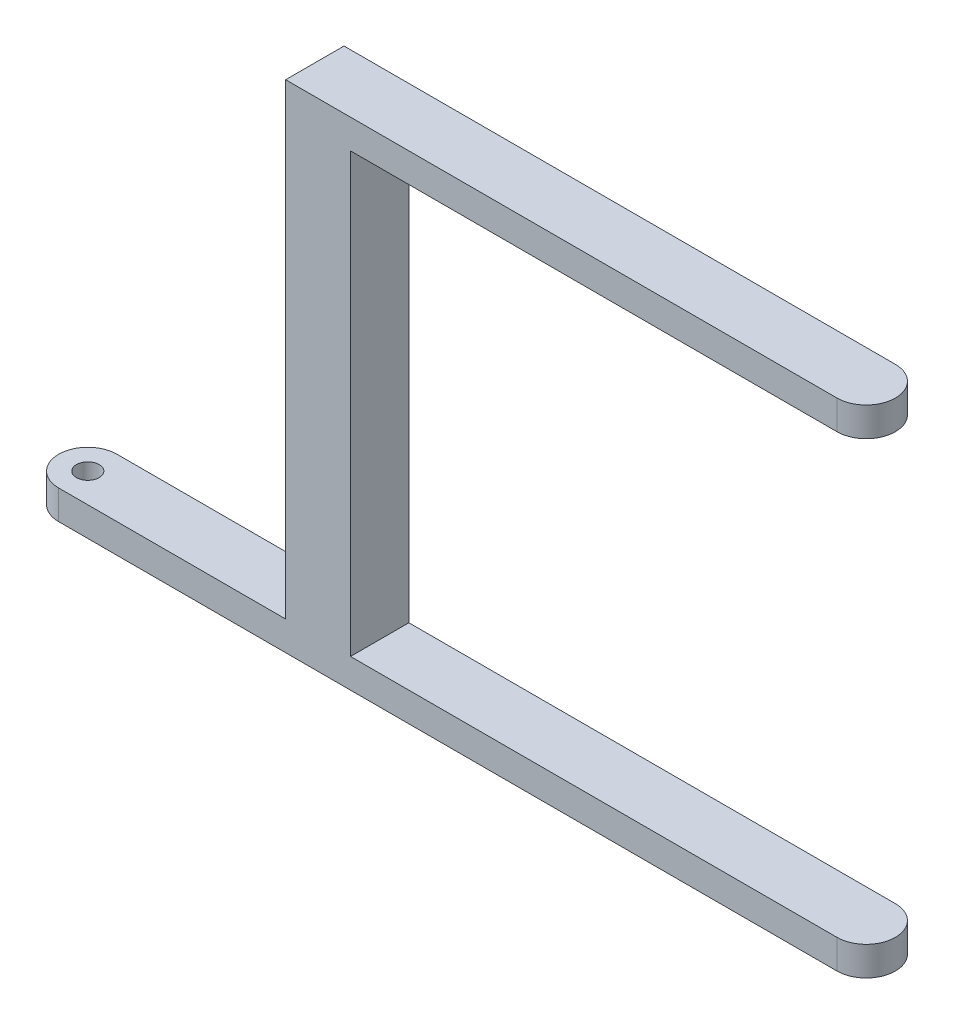
from build123d import *

# Parameters (mm, degrees)
BOSS_EXTRUDE1_DEPTH = 4.5
SKETCH2_R           = 1.75
CUT_EXTRUDE1_DEPTH  = 10
SKETCH3_W           = 10
SKETCH3_H           = 9
BOSS_EXTRUDE2_DEPTH = 67.5
SKETCH4_W           = 85
SKETCH4_H           = 9
BOSS_EXTRUDE3_DEPTH = 4.5
BOSS_EXTRUDE4_START = -4.5
SKETCH5_R           = 4.5
BOSS_EXTRUDE4_DEPTH = 4.5


with BuildPart() as part:
    # Sketch1 → Boss-Extrude1 (new body)
    with BuildSketch(Plane(origin=(0, 0, 0), x_dir=(1, 0, 0), z_dir=(0, 1, 0))):
        with BuildLine():
            Line((0, 4.5), (120, 4.5))
            ThreePointArc((120, 4.5), (124.5, 0), (120, -4.5))
            Line((120, -4.5), (0, -4.5))
            ThreePointArc((0, -4.5), (-4.5, 0), (0, 4.5))
        make_face()
    extrude(amount=BOSS_EXTRUDE1_DEPTH)

    # Sketch2 → Cut-Extrude1 (cut)
    with BuildSketch(Plane(origin=(0, 4.5, 0), x_dir=(1, 0, 0), z_dir=(0, 1, 0))):
        with Locations(Location((0, 0, 0), (0, 0, 270))):
            Circle(SKETCH2_R)
    extrude(amount=-CUT_EXTRUDE1_DEPTH, mode=Mode.SUBTRACT)

    # Sketch3 → Boss-Extrude2 (add)
    with BuildSketch(Plane(origin=(0, 4.5, 0), x_dir=(1, 0, 0), z_dir=(0, 1, 0))):
        with Locations((40, 0)):
            Rectangle(SKETCH3_W, SKETCH3_H)
    extrude(amount=BOSS_EXTRUDE2_DEPTH)

    # Sketch4 → Boss-Extrude3 (add)
    with BuildSketch(Plane(origin=(0, 72, 0), x_dir=(1, 0, 0), z_dir=(0, 1, 0))):
        with Locations((77.5, 0)):
            Rectangle(SKETCH4_W, SKETCH4_H)
    extrude(amount=BOSS_EXTRUDE3_DEPTH)

    # Sketch5 → Boss-Extrude4 (add)
    with BuildSketch(Plane(origin=(0, 76.5, 0), x_dir=(1, 0, 0), z_dir=(0, 1, 0)).offset(BOSS_EXTRUDE4_START)):
        with Locations((120, 0)):
            Circle(SKETCH5_R)
    extrude(amount=BOSS_EXTRUDE4_DEPTH)


solid = part.part
